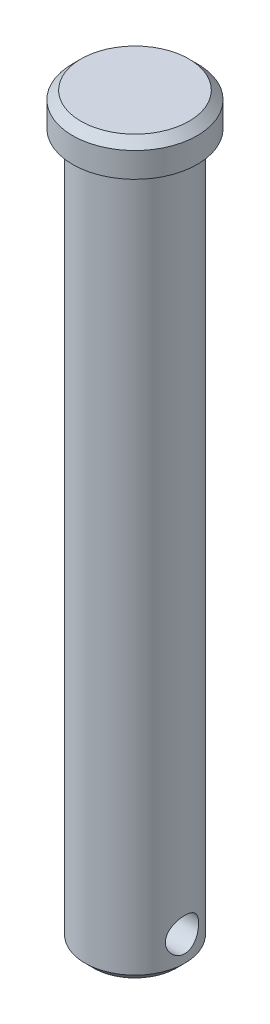
from build123d import *

# Parameters (mm, degrees)
SKETCH1_R           = 15
EXTRUDE1_DEPTH      = 8
SKETCH2_R           = 12
EXTRUDE2_DEPTH      = 170
EXTRUDE3_DEPTH      = 172.31841699
EXTRUDE3_DEPTH_BACK = 172.31841699
SKETCH3_R           = 4
CHAMFER1_SIZE       = 2


with BuildPart() as part:
    # Sketch1 → Extrude1 (new body)
    with BuildSketch(Plane(origin=(0, 0, 0), x_dir=(1, 0, 0), z_dir=(0, 1, 0))):
        with Locations(Location((0, 0, 0), (0, 0, 270))):
            Circle(SKETCH1_R)
    extrude(amount=EXTRUDE1_DEPTH)

    # Sketch2 → Extrude2 (add)
    with BuildSketch(Plane.XZ):
        with Locations(Location((0, 0, 0), (0, 0, 270))):
            Circle(SKETCH2_R)
    extrude(amount=EXTRUDE2_DEPTH)

    # Sketch3 → Extrude3 (cut, two sides: drawn at the far end of the back side and taken through both)
    with BuildSketch(Plane(origin=(0, 0, 0), x_dir=(0, 0, -1), z_dir=(1, 0, 0)).offset(-EXTRUDE3_DEPTH_BACK)):
        with Locations((0, -162)):
            Circle(SKETCH3_R)
    extrude(amount=EXTRUDE3_DEPTH + EXTRUDE3_DEPTH_BACK, mode=Mode.SUBTRACT)

    # Chamfer1
    chamfer1_edges = [part.edges().sort_by_distance(p)[0] for p in [
        (0, 8, -15),
        (0, -170, 12),
    ]]
    chamfer(chamfer1_edges, length=CHAMFER1_SIZE)


solid = part.part
